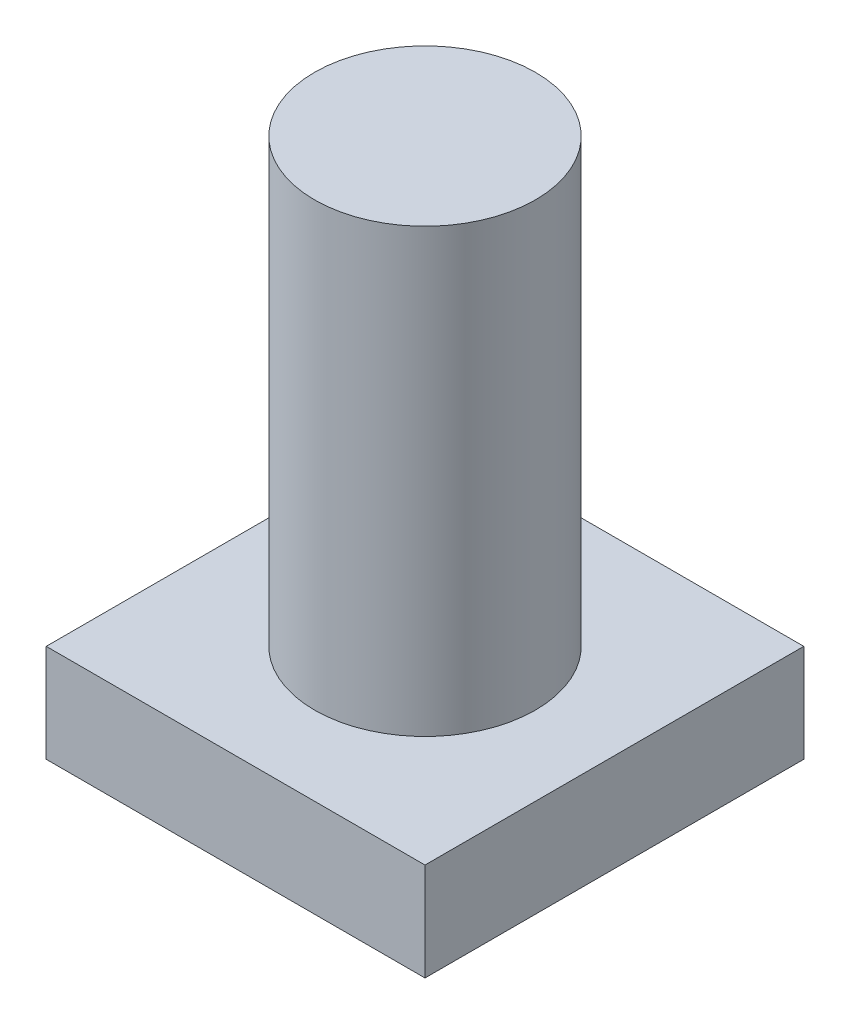
from build123d import *

# Parameters (mm, degrees)
SKETCH_1_W      = 12
SKETCH_1_H      = 12
EXTRUDE_1_DEPTH = 3.1
SKETCH_2_R      = 3.5
EXTRUDE_2_DEPTH = 14


with BuildPart() as part:
    # 草图1 → 拉伸1 (new body)
    with BuildSketch(Plane(origin=(0, 0, 0), x_dir=(1, 0, 0), z_dir=(0, 1, 0))):
        Rectangle(SKETCH_1_W, SKETCH_1_H)
    extrude(amount=EXTRUDE_1_DEPTH)

    # 草图2 → 拉伸2 (add)
    with BuildSketch(Plane(origin=(0, 3.1, 0), x_dir=(-1, 0, 0), z_dir=(0, 1, 0))):
        with Locations(Location((0, 0, 0), (0, 0, 90))):
            Circle(SKETCH_2_R)
    extrude(amount=EXTRUDE_2_DEPTH)


solid = part.part
